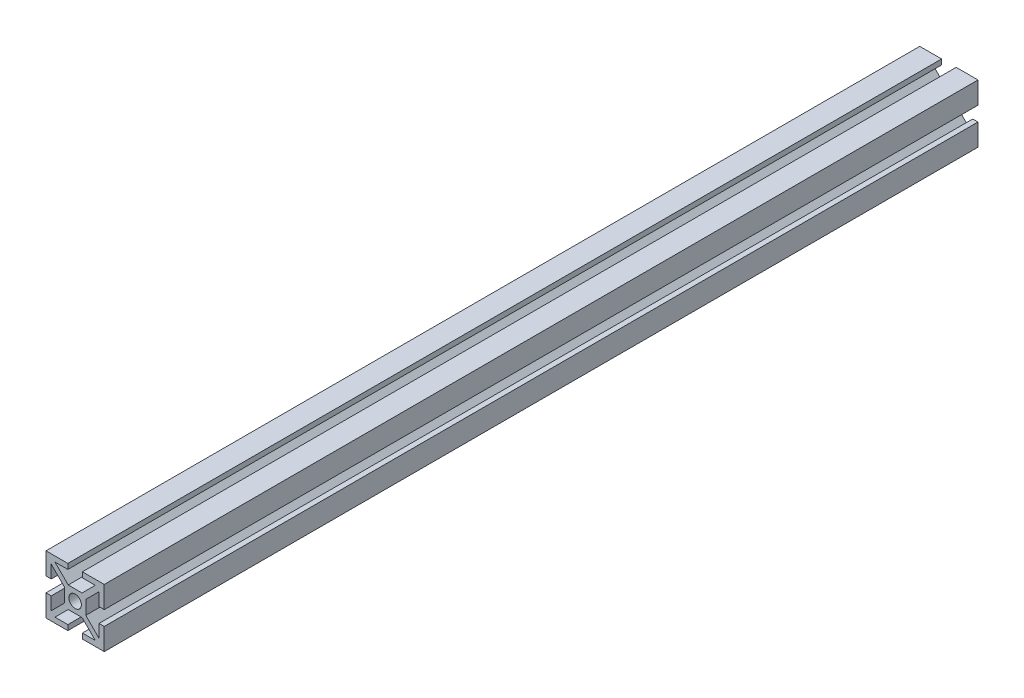
from build123d import *

# Parameters (mm, degrees)
ESQUISSE1_R        = 2.15
BOSS_EXTRU_1_DEPTH = 300


with BuildPart() as part:
    # Esquisse1 → Boss.-Extru.1 (new body)
    with BuildSketch(Plane.XY):
        Polygon((20, 12.5), (18.2, 12.5), (18.2, 16.927207794), (13.65, 12.377207794), (13.65, 10), (13.65, 7.622792206), (18.2, 3.072792206), (18.2, 7.5), (20, 7.5), (20, 0), (12.5, 0), (12.5, 1.8), (16.927207794, 1.8), (12.377207794, 6.35), (10, 6.35), (7.622792206, 6.35), (3.072792206, 1.8), (7.5, 1.8), (7.5, 0), (0, 0), (0, 7.5), (1.8, 7.5), (1.8, 3.072792206), (6.35, 7.622792206), (6.35, 10), (6.35, 12.377207794), (1.8, 16.927207794), (1.8, 12.5), (0, 12.5), (0, 20), (7.5, 20), (7.5, 18.2), (3.072792206, 18.2), (7.622792206, 13.65), (10, 13.65), (12.377207794, 13.65), (16.927207794, 18.2), (12.5, 18.2), (12.5, 20), (20, 20), align=None)
        with Locations((10, 10)):
            Circle(ESQUISSE1_R, mode=Mode.SUBTRACT)
    extrude(amount=BOSS_EXTRU_1_DEPTH)


solid = part.part
